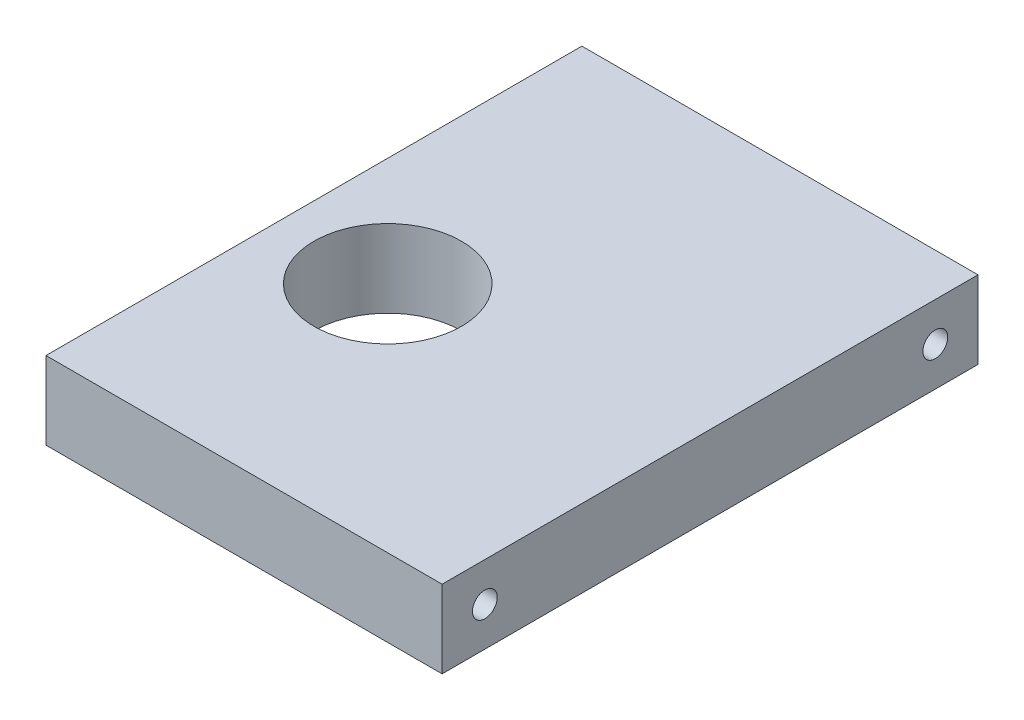
from build123d import *

# Parameters (mm, degrees)
SKETCH_1_W          = 25.5
SKETCH_1_H          = 34.5
EXTRUDE_1_DEPTH     = 5
M2X0_4_1_AT_2_COUNT = 2
M2X0_4_1_AT_2_PITCH = 29
SKETCH_4_R          = 4.75
CUT_EXTRUDE_1_DEPTH = 23.025553342


with BuildPart() as part:
    # 草图1 → 凸台-拉伸1 (new body)
    with BuildSketch(Plane(origin=(0, 0, 0), x_dir=(1, 0, 0), z_dir=(0, 1, 0))):
        Rectangle(SKETCH_1_W, SKETCH_1_H)
    extrude(amount=EXTRUDE_1_DEPTH)

    # 草图3 → M2x0.4 螺纹孔1 (revolve, cut)
    with BuildSketch(Plane(origin=(12.75, 2.5, -14.5), x_dir=(0, 0, -1), z_dir=(0, 1, 0))):
        Polygon((0, 0), (0, 5.680688495), (0.8, 5.2), (0.8, 0), align=None)
    m2x0_4_1 = revolve(axis=Axis((19.1, 2.5, -14.5), (-1, 0, 0)), mode=Mode.SUBTRACT)

    # M2x0.4 螺纹孔1 at 2: M2x0.4 螺纹孔1 ×2
    with Locations(*[(0, 0, i * M2X0_4_1_AT_2_PITCH) for i in range(1, M2X0_4_1_AT_2_COUNT)]):
        add(m2x0_4_1, mode=Mode.SUBTRACT)

    # 镜向1: M2x0.4 螺纹孔1 across plane
    add(m2x0_4_1.mirror(Plane(origin=(0, 0, 0), x_dir=(0, 0, 1), z_dir=(1, 0, 0))), mode=Mode.SUBTRACT)

    # 镜向1 copy 1 sketch → 镜向1 copy 1 (revolve, cut)
    with BuildSketch(Plane(origin=(-12.75, 2.5, 14.5), x_dir=(0, 0, -1), z_dir=(0, 1, 0))):
        Polygon((0, 0), (0, -5.680688495), (0.8, -5.2), (0.8, 0), align=None)
    revolve(axis=Axis((-19.1, 2.5, 14.5), (-1, 0, 0)), mode=Mode.SUBTRACT)

    # 草图4 → 切除-拉伸1 (cut, through all)
    with BuildSketch(Plane.XZ):
        with Locations(Location((-5.75, 2.25, 0), (0, 0, 270))):
            Circle(SKETCH_4_R)
    extrude(amount=-CUT_EXTRUDE_1_DEPTH, mode=Mode.SUBTRACT)


solid = part.part
